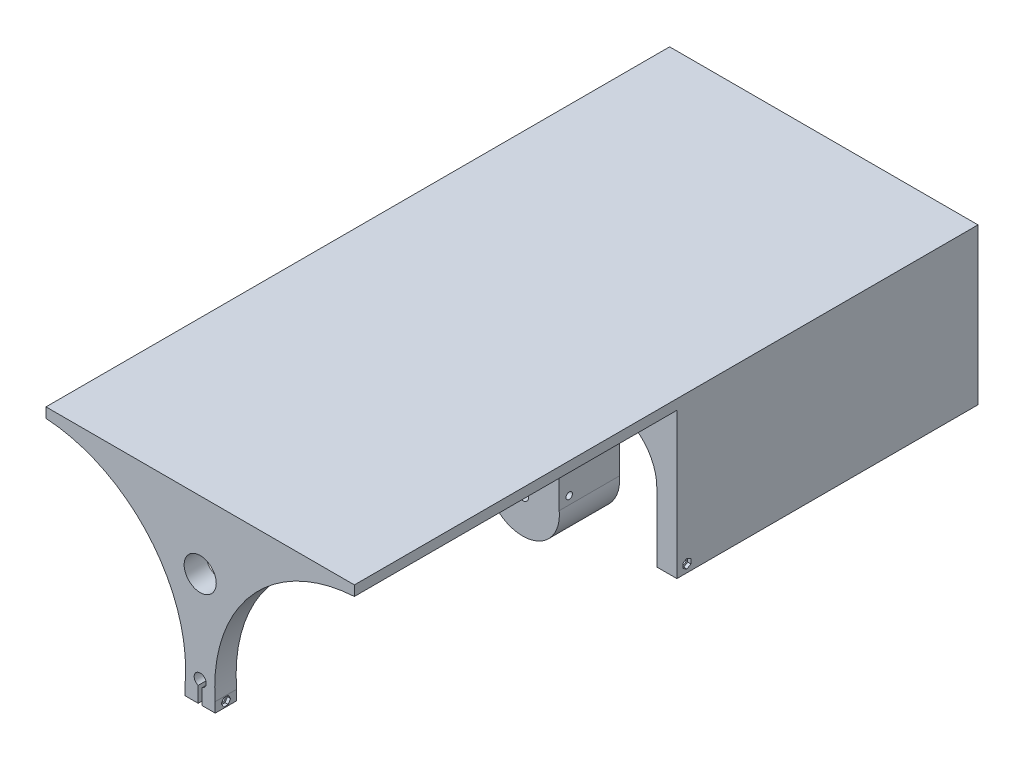
from build123d import *

# Parameters (mm, degrees)
SKETCH1_R                                           = 3
SKETCH1_R_2                                         = 8
BOSS_EXTRUDE1_DEPTH                                 = 30
BOSS_EXTRUDE2_DEPTH                                 = 120
SKETCH5_W                                           = 153.62
SKETCH5_H                                           = 9
SKETCH5_H_2                                         = 6
BOSS_EXTRUDE3_DEPTH                                 = 150
SKETCH6_W                                           = 153.62
SKETCH6_H                                           = 6
BOSS_EXTRUDE4_DEPTH                                 = 150
BOSS_EXTRUDE5_DEPTH                                 = 10.65
CUT_EXTRUDE1_REACH                                  = 337.773
SKETCH8_R                                           = 3
SKETCH8_R_2                                         = 8
SKETCH9_R                                           = 13.5
CUT_EXTRUDE2_DEPTH                                  = 22
SKETCH10_R                                          = 2
CUT_EXTRUDE3_DEPTH                                  = 6.7
SKETCH12_W                                          = 40.684038992
SKETCH12_H                                          = 10
CUT_EXTRUDE5_DEPTH                                  = 120
BOSS_EXTRUDE6_START                                 = -10
BOSS_EXTRUDE6_DEPTH                                 = 10
SKETCH11_W                                          = 153.62
SKETCH11_H                                          = 10
CUT_EXTRUDE4_DEPTH                                  = 336.773166974
CUT_EXTRUDE6_REACH                                  = 201.52
CUT_EXTRUDE6_END_RADIUS                             = 3
SKETCH14_W                                          = 2
SKETCH14_H                                          = 10.65
CSK_FOR_M2_COUNTERSUNK_FLAT_HEAD_SCREW1_D           = 2.4
CSK_FOR_M2_COUNTERSUNK_FLAT_HEAD_SCREW1_DEPTH       = 16.5
CSK_FOR_M2_COUNTERSUNK_FLAT_HEAD_SCREW1_CSINK_D     = 4.4
CSK_FOR_M2_COUNTERSUNK_FLAT_HEAD_SCREW1_CSINK_ANGLE = 90
CSK_FOR_M2_COUNTERSUNK_FLAT_HEAD_SCREW1_TIP         = 0.721032743
CUT_EXTRUDE7_DEPTH                                  = 1.6
SKETCH22_R                                          = 1.6
CUT_EXTRUDE8_DEPTH                                  = 4
CUT_EXTRUDE9_DEPTH                                  = 1.6
CUT_EXTRUDE10_REACH                                 = 240.276
SKETCH24_R                                          = 1.2


with BuildPart() as part:
    # Sketch1 → Boss-Extrude1 (new body)
    with BuildSketch(Plane.XY):
        with BuildLine():
            Line((-18.19, -47.31), (-18.19, -81.62))
            ThreePointArc((-18.19, -81.62), (0, -101.687860925), (18.19, -81.62))
            Line((18.19, -81.62), (18.19, -47.31))
            ThreePointArc((18.19, -47.31), (42.5, -23), (66.81, -47.31))
            Line((66.81, -47.31), (66.81, -81.62))
            Line((66.81, -81.62), (76.81, -81.62))
            Line((76.81, -81.62), (76.81, 0))
            Line((76.81, 0), (-76.81, 0))
            Line((-76.81, 0), (-76.81, -81.62))
            Line((-76.81, -81.62), (-66.81, -81.62))
            Line((-66.81, -81.62), (-66.81, -47.31))
            ThreePointArc((-66.81, -47.31), (-42.5, -23), (-18.19, -47.31))
        make_face()
        with Locations((0, -83.41)):
            Circle(SKETCH1_R, mode=Mode.SUBTRACT)
        with Locations((0, -37.71)):
            Circle(SKETCH1_R_2, mode=Mode.SUBTRACT)
    extrude(amount=-BOSS_EXTRUDE1_DEPTH)

    # Sketch3 → Boss-Extrude2 (add)
    with BuildSketch(Plane(origin=(0, 0, -30), x_dir=(-1, 0, 0), z_dir=(0, 0, -1))):
        with BuildLine():
            Line((-76.81, 0), (-76.81, -81.62))
            Line((-76.81, -81.62), (-66.81, -81.62))
            Line((-66.81, -81.62), (-66.81, -47.31))
            ThreePointArc((-66.81, -47.31), (-42.5, -23), (-18.19, -47.31))
            Line((-18.19, -47.31), (-18.19, -19.7))
            Line((-18.19, -19.7), (18.19, -19.7))
            Line((18.19, -19.7), (18.19, -47.31))
            ThreePointArc((18.19, -47.31), (42.5, -23), (66.81, -47.31))
            Line((66.81, -47.31), (66.81, -81.62))
            Line((66.81, -81.62), (76.81, -81.62))
            Line((76.81, -81.62), (76.81, 0))
            Line((76.81, 0), (-76.81, 0))
        make_face()
    extrude(amount=BOSS_EXTRUDE2_DEPTH)

    # Sketch5 → Boss-Extrude3 (add)
    with BuildSketch(Plane.XY):
        with Locations((0, -4.5)):
            Rectangle(SKETCH5_W, SKETCH5_H)
        with Locations((0, 3)):
            Rectangle(SKETCH5_W, SKETCH5_H_2)
    extrude(amount=BOSS_EXTRUDE3_DEPTH)

    # Sketch6 → Boss-Extrude4 (add)
    with BuildSketch(Plane(origin=(0, 0, 0), x_dir=(-1, 0, 0), z_dir=(0, 0, -1))):
        with Locations((0, 3)):
            Rectangle(SKETCH6_W, SKETCH6_H)
    extrude(amount=BOSS_EXTRUDE4_DEPTH)

    # Sketch7 → Boss-Extrude5 (add)
    with BuildSketch(Plane.XY.offset(150)):
        with BuildLine():
            Line((-76.81, -9), (-76.81, 6))
            Line((-76.81, 6), (76.81, 6))
            Line((76.81, 6), (76.81, -9))
            ThreePointArc((76.81, -9), (25.316346961, -34.411411974), (7.5, -89))
            Line((7.5, -89), (7.5, -94))
            Line((7.5, -94), (-7.5, -94))
            Line((-7.5, -94), (-7.5, -89))
            ThreePointArc((-7.5, -89), (-25.316346961, -34.411411974), (-76.81, -9))
        make_face()
    extrude(amount=BOSS_EXTRUDE5_DEPTH)

    # Sketch8 → Cut-Extrude1 (cut, up to next)
    with BuildSketch(Plane.XY.offset(160.65), mode=Mode.PRIVATE) as cut_extrude1_sk1:
        with Locations((0, -83.41)):
            Circle(SKETCH8_R)
    cut_extrude1_tool1 = extrude(cut_extrude1_sk1.sketch, amount=-CUT_EXTRUDE1_REACH, mode=Mode.PRIVATE) & part.part
    # Sketch8 → Cut-Extrude1 (cut, up to next)
    with BuildSketch(Plane.XY.offset(160.65), mode=Mode.PRIVATE) as cut_extrude1_sk2:
        with Locations((0, -37.71)):
            Circle(SKETCH8_R_2)
    cut_extrude1_tool2 = extrude(cut_extrude1_sk2.sketch, amount=-CUT_EXTRUDE1_REACH, mode=Mode.PRIVATE) & part.part
    add(cut_extrude1_tool1.solids().sort_by_distance((0, -83.41, 160.65))[0], mode=Mode.SUBTRACT)
    add(cut_extrude1_tool2.solids().sort_by_distance((0, -37.71, 160.65))[0], mode=Mode.SUBTRACT)

    # Sketch9 → Cut-Extrude2 (cut)
    with BuildSketch(Plane(origin=(0, 0, -30), x_dir=(-1, 0, 0), z_dir=(0, 0, -1))):
        with Locations((0, -37.71)):
            Circle(SKETCH9_R)
    extrude(amount=-CUT_EXTRUDE2_DEPTH, mode=Mode.SUBTRACT)

    # Sketch10 → Cut-Extrude3 (cut)
    with BuildSketch(Plane.XZ.offset(19.7)):
        with Locations((-6, -102.85)):
            Circle(SKETCH10_R)
        with Locations((6, -102.85)):
            Circle(SKETCH10_R)
    extrude(amount=-CUT_EXTRUDE3_DEPTH, mode=Mode.SUBTRACT)

    # Sketch12 → Cut-Extrude5 (cut)
    with BuildSketch(Plane(origin=(0, 0, -150), x_dir=(-1, 0, 0), z_dir=(0, 0, -1))):
        with Locations((0, -42.31)):
            Rectangle(SKETCH12_W, SKETCH12_H)
    extrude(amount=-CUT_EXTRUDE5_DEPTH, mode=Mode.SUBTRACT)

    # Sketch13 → Boss-Extrude6 (add)
    with BuildSketch(Plane(origin=(0, 0, -150), x_dir=(-1, 0, 0), z_dir=(0, 0, -1)).offset(BOSS_EXTRUDE6_START)):
        with BuildLine():
            Line((-18.19, -37.31), (-20.342019496, -37.31))
            ThreePointArc((-20.342019496, -37.31), (-18.734093684, -42.195530626), (-18.19, -47.31))
            ThreePointArc((-18.19, -47.31), (-23.625068212, -62.630347581), (-37.5, -71.100252205))
            Line((-37.5, -71.100252205), (-37.5, -81.62))
            Line((-37.5, -81.62), (-15.342019496, -81.62))
            Line((-15.342019496, -81.62), (-15.342019496, -37.31))
            Line((-15.342019496, -37.31), (-15.342019496, -19.7))
            Line((-15.342019496, -19.7), (-18.19, -19.7))
            Line((-18.19, -19.7), (-18.19, -37.31))
        make_face()
        with BuildLine():
            ThreePointArc((-47.5, -71.100252205), (-61.374931788, -62.630347581), (-66.81, -47.31))
            Line((-66.81, -47.31), (-66.81, -81.62))
            Line((-66.81, -81.62), (-47.5, -81.62))
            Line((-47.5, -81.62), (-47.5, -71.100252205))
        make_face()
    boss_extrude6 = extrude(amount=BOSS_EXTRUDE6_DEPTH)

    # Sketch11 → Cut-Extrude4 (cut, through all)
    with BuildSketch(Plane.XY.offset(160.65)):
        with Locations((0, 1)):
            Rectangle(SKETCH11_W, SKETCH11_H)
    extrude(amount=-CUT_EXTRUDE4_DEPTH, mode=Mode.SUBTRACT)

    # Mirror1: Boss-Extrude6 across plane
    add(boss_extrude6.mirror(Plane(origin=(0, 0, 0), x_dir=(0, 0, 1), z_dir=(1, 0, 0))))

    # Cut-Extrude6: up to this cylinder (the profile starts outside it)
    cut_extrude6_end = Plane(origin=(0, -83.41, 155.325), z_dir=(0, 0, 1)) * Cylinder(CUT_EXTRUDE6_END_RADIUS, 410.04, mode=Mode.PRIVATE)
    # Sketch14 → Cut-Extrude6 (cut, up to the surface)
    with BuildSketch(Plane.XZ.offset(94), mode=Mode.PRIVATE) as cut_extrude6_sk1:
        with Locations((0, 155.325)):
            Rectangle(SKETCH14_W, SKETCH14_H)
    cut_extrude6_tool1 = extrude(cut_extrude6_sk1.sketch, amount=-CUT_EXTRUDE6_REACH, mode=Mode.PRIVATE) - cut_extrude6_end
    add(cut_extrude6_tool1.solids().sort_by_distance((0, -94, 155.325))[0], mode=Mode.SUBTRACT)

    # CSK for M2 Countersunk Flat Head Screw1
    with Locations(Plane.ZY.offset(7.5)):
        with Locations((155.325, -91.5)):
            CounterSinkHole(CSK_FOR_M2_COUNTERSUNK_FLAT_HEAD_SCREW1_D / 2, CSK_FOR_M2_COUNTERSUNK_FLAT_HEAD_SCREW1_CSINK_D / 2, depth=CSK_FOR_M2_COUNTERSUNK_FLAT_HEAD_SCREW1_DEPTH, counter_sink_angle=CSK_FOR_M2_COUNTERSUNK_FLAT_HEAD_SCREW1_CSINK_ANGLE)
            with Locations((0, 0, -(CSK_FOR_M2_COUNTERSUNK_FLAT_HEAD_SCREW1_DEPTH + CSK_FOR_M2_COUNTERSUNK_FLAT_HEAD_SCREW1_TIP / 2))):  # 118° drill point
                Cone(0, CSK_FOR_M2_COUNTERSUNK_FLAT_HEAD_SCREW1_D / 2, CSK_FOR_M2_COUNTERSUNK_FLAT_HEAD_SCREW1_TIP, mode=Mode.SUBTRACT)

    # Sketch19 → Cut-Extrude7 (cut)
    with BuildSketch(Plane(origin=(7.5, 0, 0), x_dir=(0, 0, -1), z_dir=(1, 0, 0))):
        Polygon((-154.170299462, -93.5), (-153.015598923, -91.5), (-154.170299462, -89.5), (-156.479700538, -89.5), (-157.634401077, -91.5), (-156.479700538, -93.5), align=None)
    extrude(amount=-CUT_EXTRUDE7_DEPTH, mode=Mode.SUBTRACT)

    # Sketch22 → Cut-Extrude8 (cut)
    with BuildSketch(Plane.ZY.offset(18.19)):
        with Locations(Location((-5, -77.65, 0), (0, 0, 270))):
            Circle(SKETCH22_R)
    cut_extrude8 = extrude(amount=-CUT_EXTRUDE8_DEPTH, mode=Mode.SUBTRACT)

    # Mirror2: Cut-Extrude8 across plane
    add(cut_extrude8.mirror(Plane(origin=(0, 0, 0), x_dir=(0, 0, 1), z_dir=(1, 0, 0))), mode=Mode.SUBTRACT)

    # Sketch23 → Cut-Extrude9 (cut)
    with BuildSketch(Plane.ZY.offset(76.81)):
        Polygon((-5, -75.340598923), (-7, -76.495299462), (-7, -78.804700538), (-5, -79.959401077), (-3, -78.804700538), (-3, -76.495299462), align=None)
    cut_extrude9 = extrude(amount=-CUT_EXTRUDE9_DEPTH, mode=Mode.SUBTRACT)

    # Mirror3: Cut-Extrude9 across plane
    add(cut_extrude9.mirror(Plane(origin=(0, 0, 0), x_dir=(0, 0, 1), z_dir=(1, 0, 0))), mode=Mode.SUBTRACT)

    # Sketch24 → Cut-Extrude10 (cut, up to next)
    with BuildSketch(Plane(origin=(-66.81, 0, 0), x_dir=(0, 0, -1), z_dir=(1, 0, 0)), mode=Mode.PRIVATE) as cut_extrude10_sk1:
        with Locations((5, -77.65)):
            Circle(SKETCH24_R)
    cut_extrude10_tool1 = extrude(cut_extrude10_sk1.sketch, amount=-CUT_EXTRUDE10_REACH, mode=Mode.PRIVATE) & part.part
    cut_extrude10 = cut_extrude10_tool1.solids().sort_by_distance((-66.81, -77.65, -5))[0]
    add(cut_extrude10, mode=Mode.SUBTRACT)

    # Mirror4: Cut-Extrude10 across plane
    add(cut_extrude10.mirror(Plane(origin=(0, 0, 0), x_dir=(0, 0, 1), z_dir=(1, 0, 0))), mode=Mode.SUBTRACT)


solid = part.part
